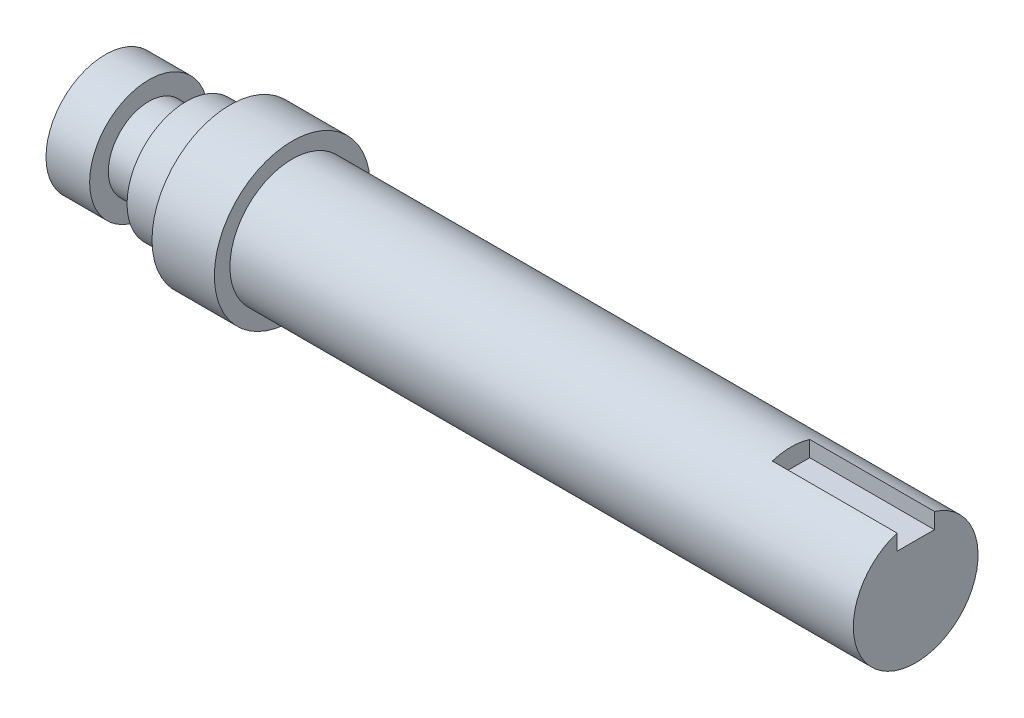
from build123d import *

# Parameters (mm, degrees)
SKETCH2_W          = 6
SKETCH2_H          = 3
SKETCH3_W          = 20
SKETCH3_H          = 5
CUT_EXTRUDE1_DEPTH = 3


with BuildPart() as part:
    # Sketch1 → Revolve1 (revolve)
    with BuildSketch(Plane.XY, mode=Mode.PRIVATE) as revolve1_sk:
        Polygon((0, 0), (0, 10), (-100, 10), (-100, 12.5), (-110, 12.5), (-110, 9.5), (-130, 9.5), (-130, 0), align=None)
    revolve(revolve1_sk.sketch.rotate(Axis((-130, 0, 0), (1, 0, 0)), 90), axis=Axis((-130, 0, 0), (1, 0, 0)))

    # Sketch2 → Cut-Revolve1 (revolve, cut)
    with BuildSketch(Plane.XY, mode=Mode.PRIVATE) as cut_revolve1_sk:
        with Locations((-120, 8)):
            Rectangle(SKETCH2_W, SKETCH2_H)
    revolve(cut_revolve1_sk.sketch.rotate(Axis((-130, 0, 0), (1, 0, 0)), 90), axis=Axis((-130, 0, 0), (1, 0, 0)), mode=Mode.SUBTRACT)

    # Sketch3 → Cut-Extrude1 (cut, symmetric)
    with BuildSketch(Plane.XY):
        with Locations((-10, 9.5)):
            Rectangle(SKETCH3_W, SKETCH3_H)
    extrude(amount=CUT_EXTRUDE1_DEPTH, both=True, mode=Mode.SUBTRACT)


solid = part.part
